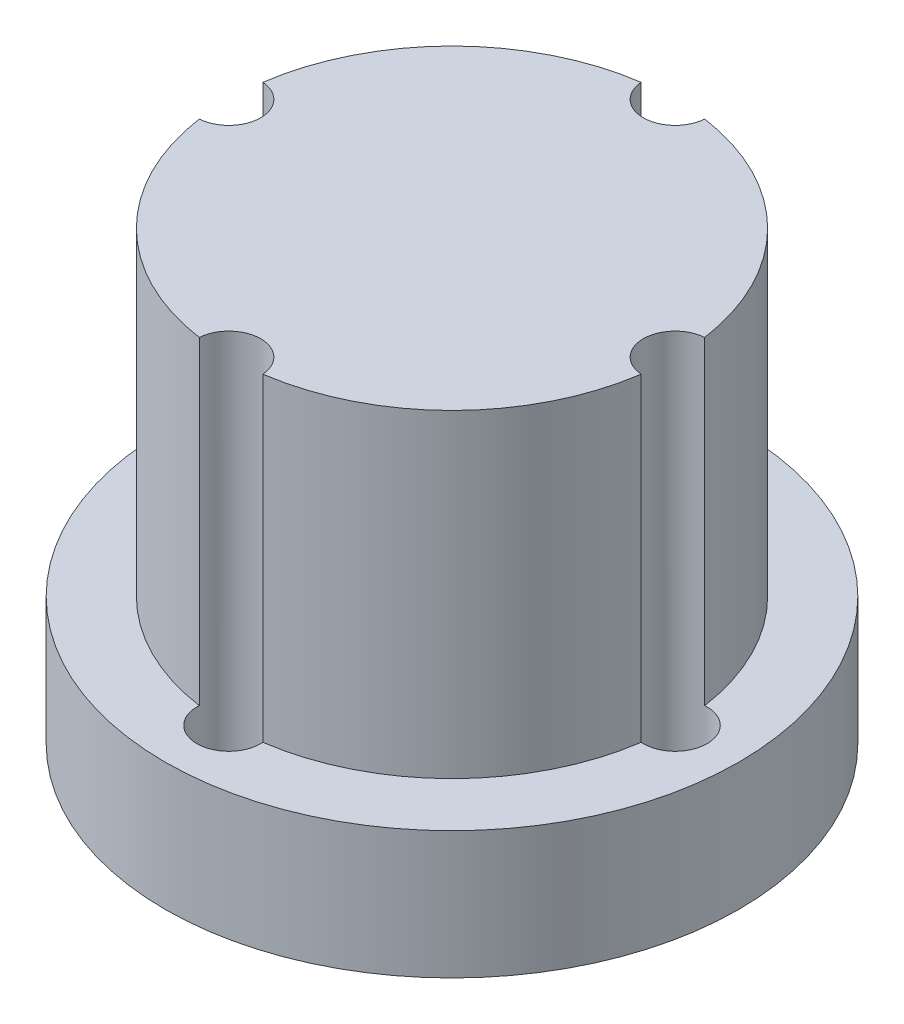
from build123d import *

# Parameters (mm, degrees)
SKETCH_1_R          = 9
EXTRUDE_1_DEPTH     = 14
SKETCH_2_R          = 1
CUT_EXTRUDE_1_DEPTH = 20
CUT_EXTRUDE_START   = -10
SKETCH_3_R          = 9
SKETCH_3_R_2        = 7
CUT_EXTRUDE_2_DEPTH = 10


with BuildPart() as part:
    # Эскиз1 → Бобышка-Вытянуть1 (new body)
    with BuildSketch(Plane(origin=(0, 0, 0), x_dir=(1, 0, 0), z_dir=(0, 1, 0))):
        with Locations(Location((0, 0, 0), (0, 0, 270))):
            Circle(SKETCH_1_R)
    extrude(amount=EXTRUDE_1_DEPTH)

    # Эскиз2 → Вырез-Вытянуть1 (cut)
    with BuildSketch(Plane(origin=(0, 14, 0), x_dir=(1, 0, 0), z_dir=(0, 1, 0))):
        with Locations(Location((0, 7, 0), (0, 0, 270))):
            Circle(SKETCH_2_R)
        with Locations(Location((7, 0, 0), (0, 0, 270))):
            Circle(SKETCH_2_R)
        with Locations(Location((-7, 0, 0), (0, 0, 270))):
            Circle(SKETCH_2_R)
        with Locations(Location((0, -7, 0), (0, 0, 270))):
            Circle(SKETCH_2_R)
    extrude(amount=-CUT_EXTRUDE_1_DEPTH, mode=Mode.SUBTRACT)

    # Эскиз3 → Вырез-Вытянуть2 (cut)
    with BuildSketch(Plane(origin=(0, 14, 0), x_dir=(1, 0, 0), z_dir=(0, 1, 0)).offset(CUT_EXTRUDE_START)):
        with Locations(Location((0, 0, 0), (0, 0, 270))):
            Circle(SKETCH_3_R)
        Circle(SKETCH_3_R_2, mode=Mode.SUBTRACT)
    extrude(amount=CUT_EXTRUDE_2_DEPTH, mode=Mode.SUBTRACT)


solid = part.part
